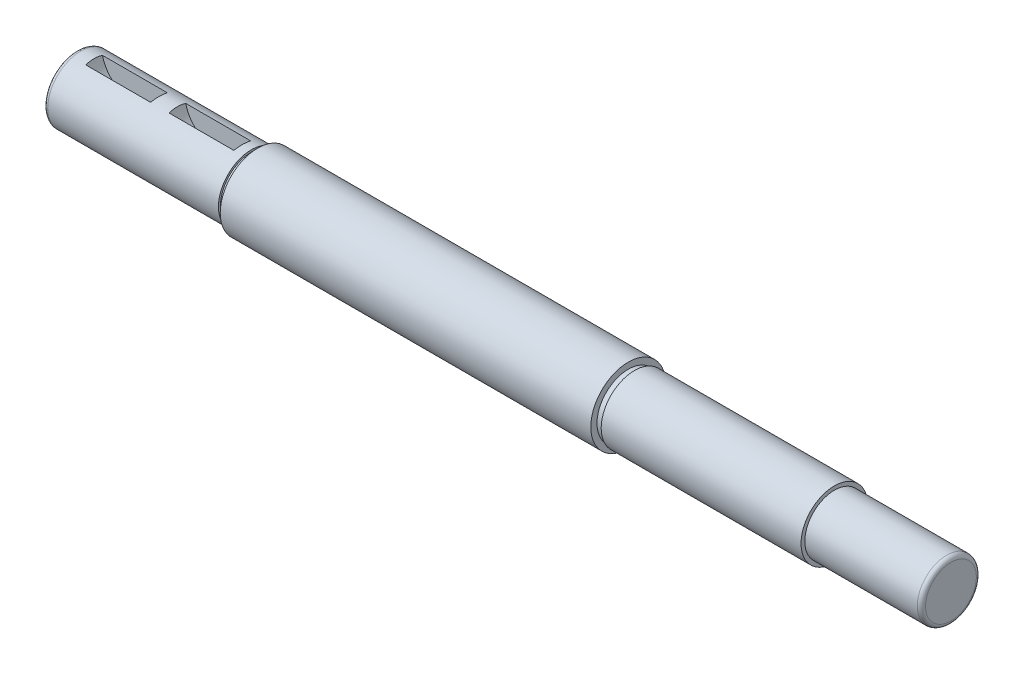
from build123d import *

# Parameters (mm, degrees)
FILLET1_R          = 1.5875
CUT_EXTRUDE1_DEPTH = 3.175
LPATTERN1_COUNT    = 2
LPATTERN1_PITCH    = 31.75
CUT_EXTRUDE2_DEPTH = 3.175


with BuildPart() as part:
    # Sketch1 → Revolve1 (revolve)
    with BuildSketch(Plane.XY, mode=Mode.PRIVATE) as revolve1_sk:
        Polygon((-54.628661224, 0), (-54.628661224, 12.573), (12.046338776, 12.573), (12.046338776, 11.77925), (14.427588776, 11.77925), (14.427588776, 14.2748), (155.715088776, 14.2748), (155.715088776, 11.9126), (158.096338776, 11.9126), (158.096338776, 12.70635), (234.296338776, 12.70635), (234.296338776, 11.2649), (278.746338776, 11.2649), (278.746338776, 0), align=None)
    revolve(revolve1_sk.sketch.rotate(Axis((-43.218877551, 0, 0), (1, 0, 0)), 90), axis=Axis((-43.218877551, 0, 0), (1, 0, 0)))

    # Fillet1
    fillet1_edges = [part.edges().sort_by_distance(p)[0] for p in [
        (-54.628661224, 0, -12.573),
        (278.746338776, 0, -11.2649),
    ]]
    fillet(fillet1_edges, radius=FILLET1_R)

    # Sketch2 → Cut-Extrude1 (cut, symmetric)
    with BuildSketch(Plane.XY):
        with BuildLine():
            Line((-48.022069118, 12.573), (-23.135253331, 12.573))
            ThreePointArc((-23.135253331, 12.573), (-35.578661224, 2.413), (-48.022069118, 12.573))
        make_face()
    cut_extrude1 = extrude(amount=CUT_EXTRUDE1_DEPTH, both=True, mode=Mode.SUBTRACT)

    # LPattern1: Cut-Extrude1 ×2
    with Locations(*[(i * LPATTERN1_PITCH, 0, 0) for i in range(1, LPATTERN1_COUNT)]):
        add(cut_extrude1, mode=Mode.SUBTRACT)

    # Sketch3 → Cut-Extrude2 (cut, symmetric)
    with BuildSketch(Plane.XY):
        with BuildLine():
            Line((162.321680882, -12.70635), (187.208496669, -12.70635))
            ThreePointArc((187.208496669, -12.70635), (174.765088776, -2.54635), (162.321680882, -12.70635))
        make_face()
        with BuildLine():
            Line((200.421680882, -12.70635), (225.308496669, -12.70635))
            ThreePointArc((225.308496669, -12.70635), (212.865088776, -2.54635), (200.421680882, -12.70635))
        make_face()
    extrude(amount=CUT_EXTRUDE2_DEPTH, both=True, mode=Mode.SUBTRACT)


solid = part.part
